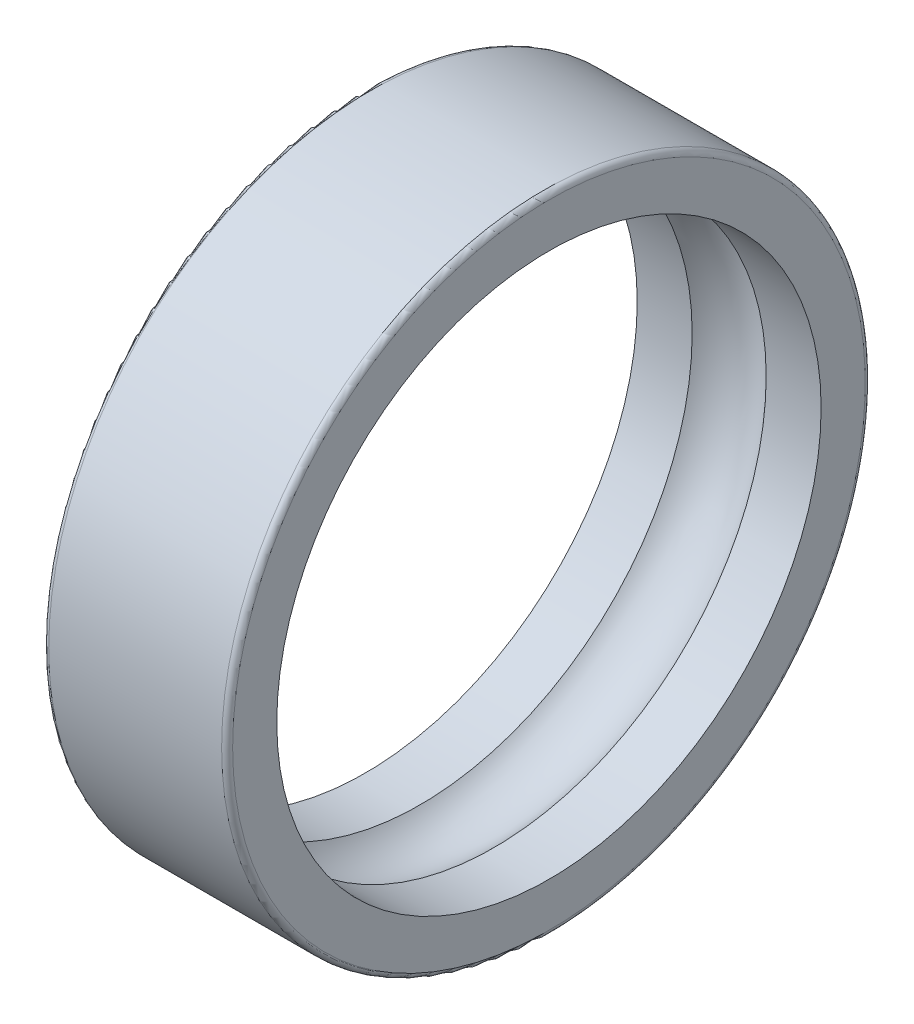
from build123d import *


with BuildPart() as part:
    # Esquisse1 → Base-Révolution (revolve)
    with BuildSketch(Plane(origin=(0, 0, 0), x_dir=(1, 0, 0), z_dir=(0, 1, 0))):
        with BuildLine():
            Line((0, 17.2), (0, 14.8))
            Line((0, 14.8), (2.98753882, 14.8))
            ThreePointArc((2.98753882, 14.8), (5, 15.7), (7.01246118, 14.8))
            Line((7.01246118, 14.8), (10, 14.8))
            Line((10, 14.8), (10, 17.2))
            ThreePointArc((10, 17.2), (9.912132034, 17.412132034), (9.7, 17.5))
            Line((9.7, 17.5), (0.3, 17.5))
            ThreePointArc((0.3, 17.5), (0.087867966, 17.412132034), (0, 17.2))
        make_face()
    revolve(axis=Axis((0, 0, 0), (1, 0, 0)))


solid = part.part
